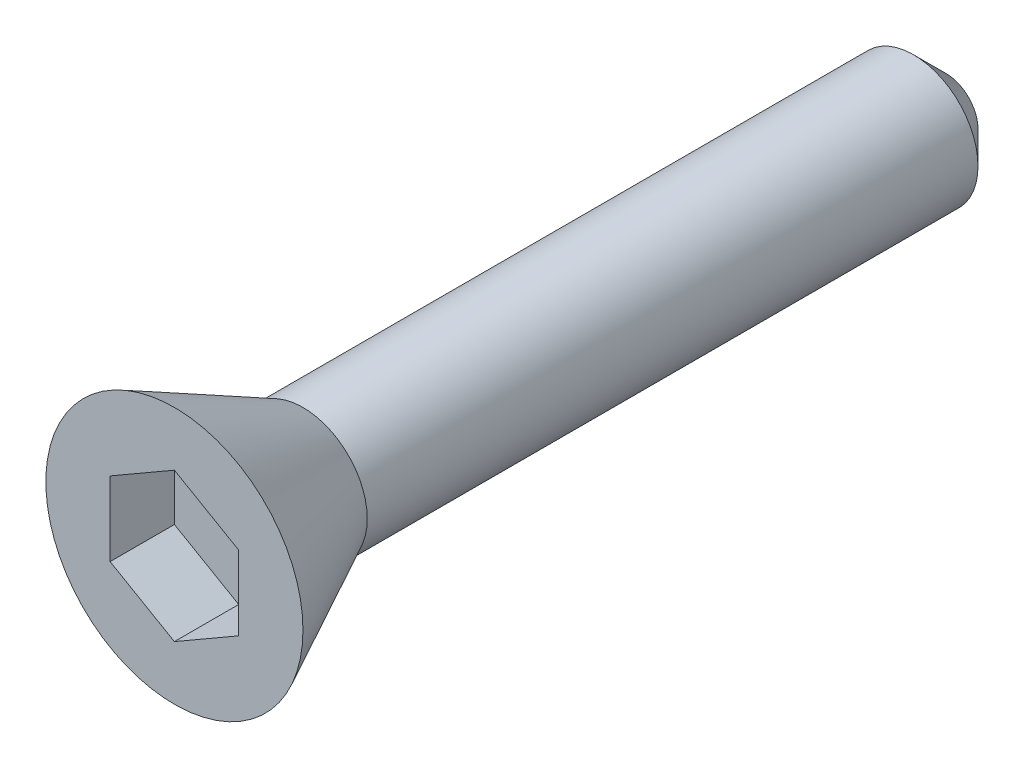
from build123d import *

# Parameters (mm, degrees)
FOOTPRINT_DEPTH = 1
CHAMFER1_SIZE   = 0.5


with BuildPart() as part:
    # Sketch1 → Body (revolve)
    with BuildSketch(Plane(origin=(0, 0, 0), x_dir=(0, 0, -1), z_dir=(1, 0, 0)), mode=Mode.PRIVATE) as body_sk:
        Polygon((0, 0), (0, 2), (2, 1), (12, 1), (12, 0), align=None)
    revolve(body_sk.sketch.rotate(Axis((0, 0, 58.51474448), (0, 0, -1)), 90), axis=Axis((0, 0, 58.51474448), (0, 0, -1)))

    # Sketch2 → Footprint (cut)
    with BuildSketch(Plane.XY):
        Polygon((0, 1.154700538), (-1, 0.577350269), (-1, -0.577350269), (0, -1.154700538), (1, -0.577350269), (1, 0.577350269), align=None)
    extrude(amount=-FOOTPRINT_DEPTH, mode=Mode.SUBTRACT)

    # Chamfer1
    chamfer1_edges = [part.edges().sort_by_distance(p)[0] for p in [
        (-1, 0, -12),
    ]]
    chamfer(chamfer1_edges, length=CHAMFER1_SIZE)


solid = part.part
